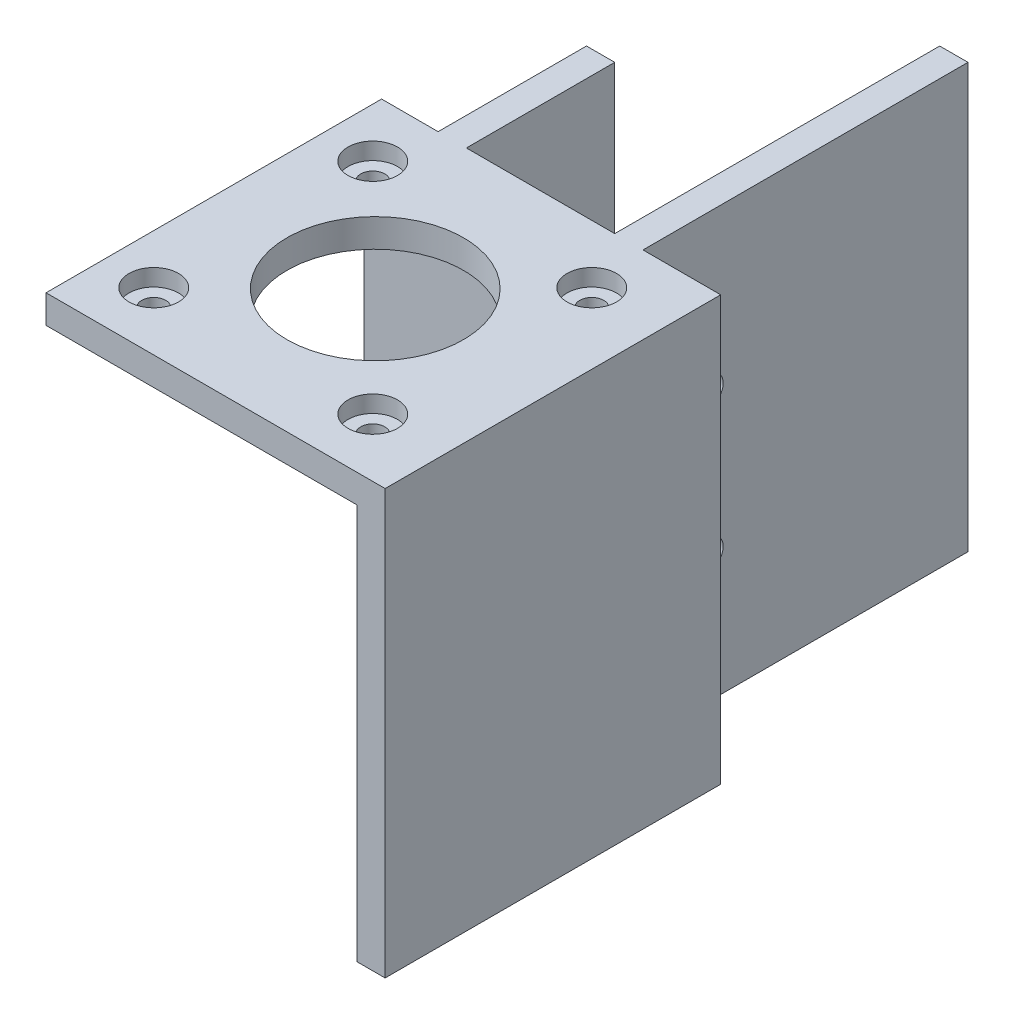
from build123d import *

# Parameters (mm, degrees)
SKETCH1_W                                           = 45
SKETCH1_H                                           = 60
BOSS_EXTRUDE1_DEPTH                                 = 23.5
SKETCH2_W                                           = 45
SKETCH2_H                                           = 4
BOSS_EXTRUDE2_DEPTH                                 = 45
SKETCH4_W                                           = 21
SKETCH4_H                                           = 21
CUT_EXTRUDE1_DEPTH                                  = 80.552141881
CUT_EXTRUDE2_REACH                                  = 81.552
SKETCH5_R                                           = 12.5
SKETCH13_W                                          = 21
SKETCH13_H                                          = 60
CUT_EXTRUDE3_DEPTH                                  = 8
SKETCH14_W                                          = 21
SKETCH14_H                                          = 60
CUT_EXTRUDE4_DEPTH                                  = 8
SKETCH22_W                                          = 4
SKETCH22_H                                          = 60
BOSS_EXTRUDE6_DEPTH                                 = 25
CBORE_FOR_M3_PAN_HEAD_MACHINE_SCREW1_D              = 3.4
CBORE_FOR_M3_PAN_HEAD_MACHINE_SCREW1_DEPTH          = 4.001
CBORE_FOR_M3_PAN_HEAD_MACHINE_SCREW1_CBORE_D        = 7
CBORE_FOR_M3_PAN_HEAD_MACHINE_SCREW1_CBORE_DEPTH    = 2.4
CBORE_FOR_M3_PAN_HEAD_MACHINE_SCREW1_ON_D           = 3.4
CBORE_FOR_M3_PAN_HEAD_MACHINE_SCREW1_ON_DEPTH       = 4.001
CBORE_FOR_M3_PAN_HEAD_MACHINE_SCREW1_ON_CBORE_D     = 7
CBORE_FOR_M3_PAN_HEAD_MACHINE_SCREW1_ON_CBORE_DEPTH = 2.4
SKETCH16_R                                          = 2.1
CUT_EXTRUDE5_DEPTH                                  = 86.564303305
BOSS_EXTRUDE5_DEPTH                                 = 3
BOSS_EXTRUDE5_DEPTH_BACK                            = 1
SKETCH21_W                                          = 47.5
SKETCH21_H                                          = 60


with BuildPart() as part:
    # Sketch1 → Boss-Extrude1 (new body)
    with BuildSketch(Plane.XY):
        with Locations((-4.024390244, 30)):
            Rectangle(SKETCH1_W, SKETCH1_H)
    extrude(amount=-BOSS_EXTRUDE1_DEPTH)

    # Sketch2 → Boss-Extrude2 (add)
    with BuildSketch(Plane.XY):
        with Locations((-4.024390244, 58)):
            Rectangle(SKETCH2_W, SKETCH2_H)
    extrude(amount=BOSS_EXTRUDE2_DEPTH)

    # Sketch4 → Cut-Extrude1 (cut, through all)
    with BuildSketch(Plane.XZ):
        with Locations((-4.024390244, -13)):
            Rectangle(SKETCH4_W, SKETCH4_H)
    extrude(amount=-CUT_EXTRUDE1_DEPTH, mode=Mode.SUBTRACT)

    # Sketch5 → Cut-Extrude2 (cut, up to next)
    with BuildSketch(Plane(origin=(0, 60, 0), x_dir=(1, 0, 0), z_dir=(0, 1, 0)), mode=Mode.PRIVATE) as cut_extrude2_sk1:
        with Locations(Location((-3.724390244, -21.2, 0), (0, 0, 270))):
            Circle(SKETCH5_R)
    cut_extrude2_tool1 = extrude(cut_extrude2_sk1.sketch, amount=-CUT_EXTRUDE2_REACH, mode=Mode.PRIVATE) & part.part
    add(cut_extrude2_tool1.solids().sort_by_distance((-3.72439, 60, 21.2))[0], mode=Mode.SUBTRACT)

    # Sketch13 → Cut-Extrude3 (cut)
    with BuildSketch(Plane(origin=(18.475609756, 0, 0), x_dir=(0, 0, -1), z_dir=(1, 0, 0))):
        with Locations((13, 30)):
            Rectangle(SKETCH13_W, SKETCH13_H)
    extrude(amount=-CUT_EXTRUDE3_DEPTH, mode=Mode.SUBTRACT)

    # Sketch14 → Cut-Extrude4 (cut)
    with BuildSketch(Plane.ZY.offset(26.524390244)):
        with Locations((-13, 30)):
            Rectangle(SKETCH14_W, SKETCH14_H)
    extrude(amount=-CUT_EXTRUDE4_DEPTH, mode=Mode.SUBTRACT)

    # Sketch22 → Boss-Extrude6 (add)
    with BuildSketch(Plane(origin=(0, 0, -23.5), x_dir=(-1, 0, 0), z_dir=(0, 0, -1))):
        with Locations((-8.475609756, 30)):
            Rectangle(SKETCH22_W, SKETCH22_H)
    extrude(amount=BOSS_EXTRUDE6_DEPTH)

    # CBORE for M3 Pan Head Machine Screw1
    with Locations(Plane(origin=(-19.524390244, 60, 5.75), x_dir=(0, 0, 1), z_dir=(0, 1, 0))):
        with Locations((0, 0), (31, 31), (31, 0), (0, 31)):
            CounterBoreHole(CBORE_FOR_M3_PAN_HEAD_MACHINE_SCREW1_D / 2, CBORE_FOR_M3_PAN_HEAD_MACHINE_SCREW1_CBORE_D / 2, CBORE_FOR_M3_PAN_HEAD_MACHINE_SCREW1_CBORE_DEPTH, depth=CBORE_FOR_M3_PAN_HEAD_MACHINE_SCREW1_DEPTH)

    # CBORE for M3 Pan Head Machine Screw1 on
    with Locations(Plane(origin=(-42.937475152, 0, 35.255713856), x_dir=(0, 0, 1), z_dir=(0, 1, 0))):
        with Locations((0, 0)):
            CounterBoreHole(CBORE_FOR_M3_PAN_HEAD_MACHINE_SCREW1_ON_D / 2, CBORE_FOR_M3_PAN_HEAD_MACHINE_SCREW1_ON_CBORE_D / 2, CBORE_FOR_M3_PAN_HEAD_MACHINE_SCREW1_ON_CBORE_DEPTH, depth=CBORE_FOR_M3_PAN_HEAD_MACHINE_SCREW1_ON_DEPTH)

    # Sketch16 → Cut-Extrude5 (cut, through all)
    with BuildSketch(Plane.ZY.offset(18.524390244)):
        with Locations(Location((-11.75, 38, 0), (0, 0, 270))):
            Circle(SKETCH16_R)
        with Locations((-11.75, 18)):
            Circle(SKETCH16_R)
    extrude(amount=-CUT_EXTRUDE5_DEPTH, mode=Mode.SUBTRACT)

    # Sketch21 → Boss-Extrude5 (add, two sides: drawn at the far end of the back side and taken through both)
    with BuildSketch(Plane(origin=(18.475609756, 0, 0), x_dir=(0, 0, -1), z_dir=(1, 0, 0)).offset(-BOSS_EXTRUDE5_DEPTH_BACK)):
        with Locations((-21.25, 30)):
            Rectangle(SKETCH21_W, SKETCH21_H)
    extrude(amount=BOSS_EXTRUDE5_DEPTH + BOSS_EXTRUDE5_DEPTH_BACK)


solid = part.part
